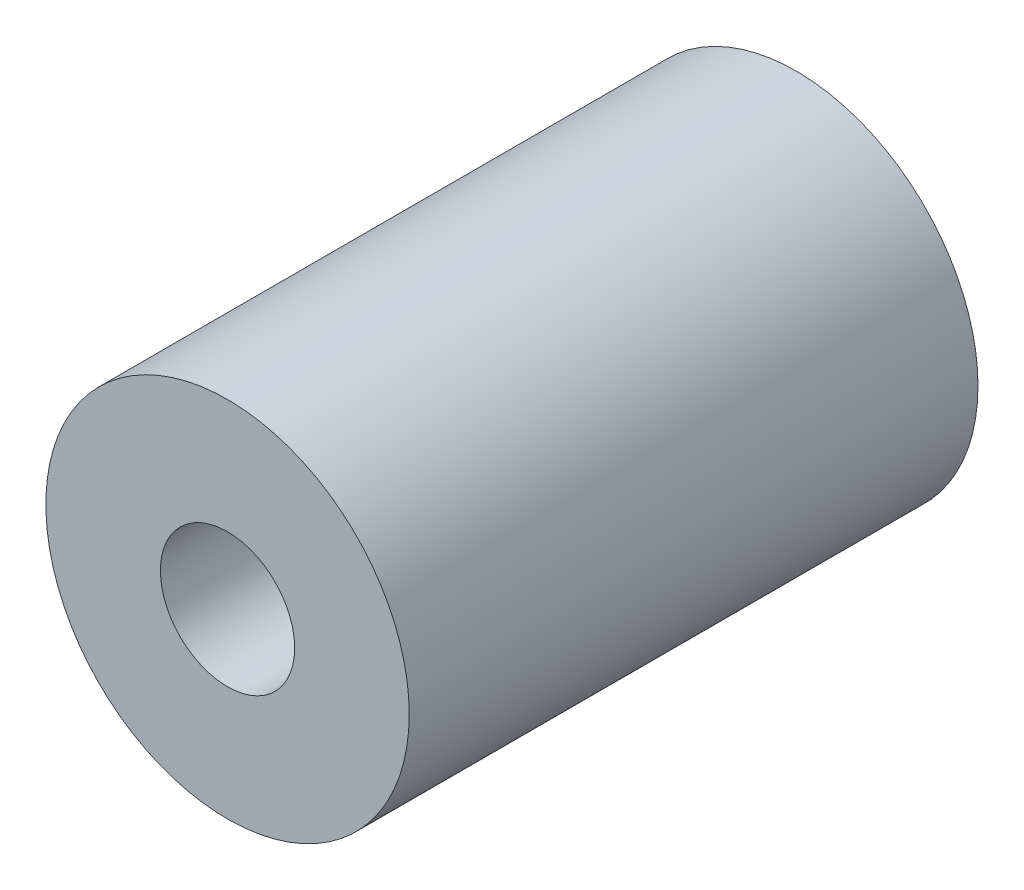
from build123d import *

# Parameters (mm, degrees)
SKETCH1_R           = 2.3
BOSS_EXTRUDE1_DEPTH = 7.2
SKETCH2_R           = 0.85
CUT_EXTRUDE1_DEPTH  = 3.6


with BuildPart() as part:
    # Sketch1 → Boss-Extrude1 (new body)
    with BuildSketch(Plane.XY):
        Circle(SKETCH1_R)
    extrude(amount=BOSS_EXTRUDE1_DEPTH)

    # Sketch2 → Cut-Extrude1 (cut)
    with BuildSketch(Plane.XY.offset(7.2)):
        Circle(SKETCH2_R)
    extrude(amount=-CUT_EXTRUDE1_DEPTH, mode=Mode.SUBTRACT)


solid = part.part
